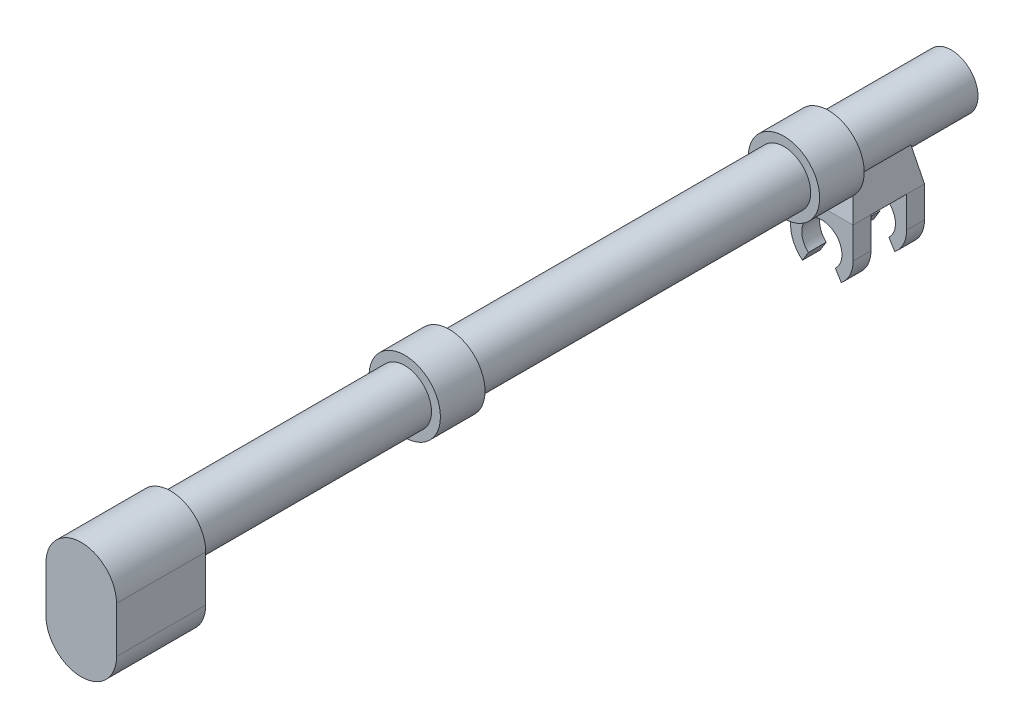
from build123d import *

# Parameters (mm, degrees)
SKETCH1_R           = 6
BOSS_EXTRUDE1_DEPTH = 97.5
SKETCH6_W           = 14
SKETCH6_H           = 4
BOSS_EXTRUDE2_DEPTH = 14
SKETCH7_R           = 4.5
CUT_EXTRUDE1_DEPTH  = 184.709009136
CUT_EXTRUDE2_DEPTH  = 184.709009136
SKETCH9_R           = 8
BOSS_EXTRUDE3_DEPTH = 5
BOSS_EXTRUDE4_DEPTH = 20
BOSS_EXTRUDE5_START = 10
SKETCH11_R          = 8
BOSS_EXTRUDE5_DEPTH = 10
CUT_EXTRUDE3_REACH  = 185.75


with BuildPart() as part:
    # Sketch1 → Boss-Extrude1 (new, symmetric)
    with BuildSketch(Plane.XY):
        Circle(SKETCH1_R)
    extrude(amount=BOSS_EXTRUDE1_DEPTH, both=True)

    # Sketch4 → Loft1 section 0
    with BuildSketch(Plane(origin=(0, 0, 0), x_dir=(1, 0, 0), z_dir=(0, 1, 0))):
        with BuildLine():
            Line((-5, 82.5), (5, 82.5))
            Line((5, 82.5), (5, 70.5))
            Line((5, 70.5), (-5, 70.5))
            Line((-5, 70.5), (-5, 82.5))
        make_face()
    # Sketch5 → Loft1 section 1
    with BuildSketch(Plane(origin=(0, -10, 0), x_dir=(1, 0, 0), z_dir=(0, 1, 0))):
        with BuildLine():
            Line((-7, 84.5), (7, 84.5))
            Line((7, 84.5), (7, 68.5))
            Line((7, 68.5), (-7, 68.5))
            Line((-7, 68.5), (-7, 84.5))
        make_face()
    loft()

    # Sketch6 → Boss-Extrude2 (add)
    with BuildSketch(Plane.XZ.offset(10)):
        with Locations((0, -70.5)):
            Rectangle(SKETCH6_W, SKETCH6_H)
        with Locations((0, -82.5)):
            Rectangle(SKETCH6_W, SKETCH6_H)
    extrude(amount=BOSS_EXTRUDE2_DEPTH)

    # Sketch7 → Cut-Extrude1 (cut, through all)
    with BuildSketch(Plane(origin=(0, 0, -84.5), x_dir=(-1, 0, 0), z_dir=(0, 0, -1))):
        with Locations((0, -17)):
            Circle(SKETCH7_R)
    extrude(amount=-CUT_EXTRUDE1_DEPTH, mode=Mode.SUBTRACT)

    # Sketch8 → Cut-Extrude2 (cut, through all)
    with BuildSketch(Plane(origin=(0, 0, -84.5), x_dir=(-1, 0, 0), z_dir=(0, 0, -1))):
        with BuildLine():
            Line((7, -24), (7, -17))
            ThreePointArc((7, -17), (4.949747468, -21.949747468), (0, -24))
            Line((0, -24), (7, -24))
        make_face()
        with BuildLine():
            Line((-7, -24), (0, -24))
            ThreePointArc((0, -24), (-4.949747468, -21.949747468), (-7, -17))
            Line((-7, -17), (-7, -24))
        make_face()
    extrude(amount=-CUT_EXTRUDE2_DEPTH, mode=Mode.SUBTRACT)

    # Sketch9 → Boss-Extrude3 (add, symmetric)
    with BuildSketch(Plane.XY.offset(-65)):
        with Locations(Location((0, 0, 0), (0, 0, 220.893267512))):
            Circle(SKETCH9_R)
    extrude(amount=BOSS_EXTRUDE3_DEPTH, both=True)

    # Sketch10 → Boss-Extrude4 (add)
    with BuildSketch(Plane.XY.offset(97.5)):
        with BuildLine():
            Line((7.903295429, 0), (7.903295429, -10.316))
            ThreePointArc((7.903295429, -10.316), (0, -18.219295429), (-7.903295429, -10.316))
            Line((-7.903295429, -10.316), (-7.903295429, 0))
            ThreePointArc((-7.903295429, 0), (0, 7.903295429), (7.903295429, 0))
        make_face()
    extrude(amount=-BOSS_EXTRUDE4_DEPTH)

    # Sketch11 → Boss-Extrude5 (add)
    with BuildSketch(Plane.XY.offset(15).offset(BOSS_EXTRUDE5_START)):
        with Locations(Location((0, 0, 0), (0, 0, 220.893267512))):
            Circle(SKETCH11_R)
    extrude(amount=-BOSS_EXTRUDE5_DEPTH)

    # Cut-Extrude3: up to this face of the body (flat: up to its plane)
    cut_extrude3_end = Plane(part.part.faces().sort_by_distance((0, -10.197989899, -68.5))[0])
    # Sketch12 → Cut-Extrude3 (cut, up to the picked face)
    with BuildSketch(Plane(origin=(0, 0, -84.5), x_dir=(-1, 0, 0), z_dir=(0, 0, -1)), mode=Mode.PRIVATE) as cut_extrude3_sk1:
        with BuildLine():
            Line((-3.020088902, -20.336025033), (-4.335882431, -22.495463906))
            ThreePointArc((-4.335882431, -22.495463906), (0, -24), (4.335882431, -22.495463906))
            Line((4.335882431, -22.495463906), (3.020088902, -20.336025033))
            ThreePointArc((3.020088902, -20.336025033), (0, -21.5), (-3.020088902, -20.336025033))
        make_face()
    cut_extrude3_tool1 = split(extrude(cut_extrude3_sk1.sketch, amount=-CUT_EXTRUDE3_REACH, mode=Mode.PRIVATE), bisect_by=cut_extrude3_end, keep=Keep.BOTH, mode=Mode.PRIVATE)
    add(cut_extrude3_tool1.solids().sort_by(Axis((0, -22.366545, -84.5), (0, 0, 1)))[0], mode=Mode.SUBTRACT)


solid = part.part
